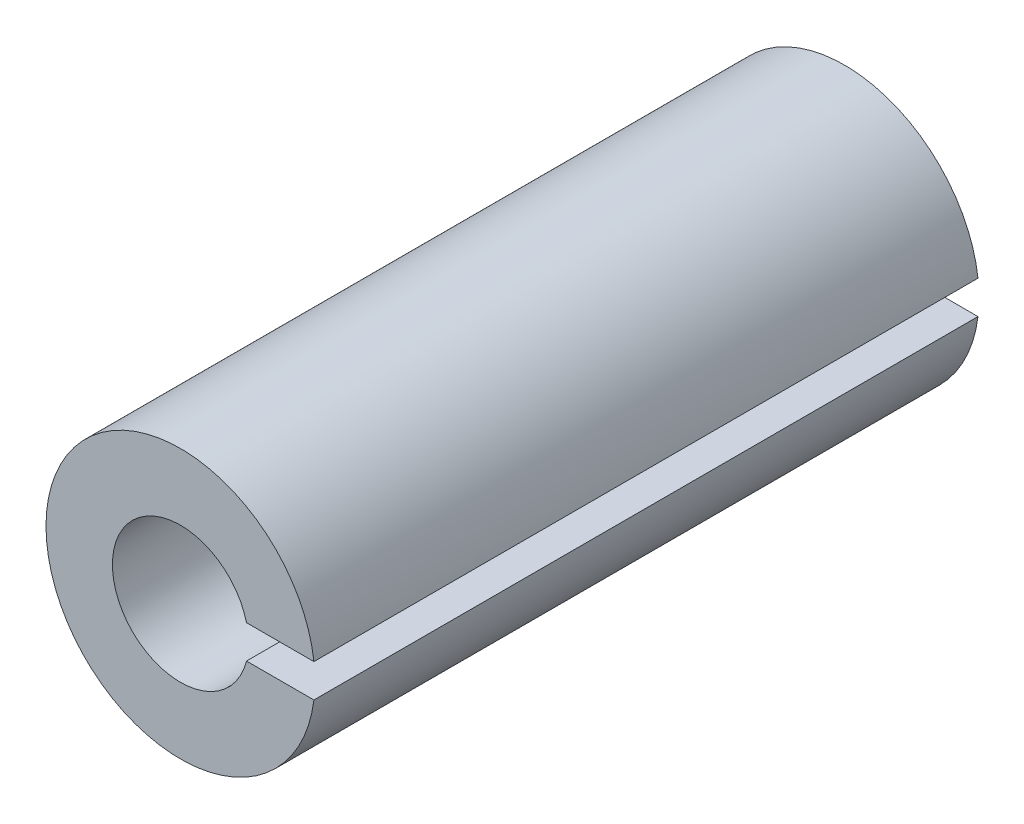
from build123d import *

# Parameters (mm, degrees)
SKETCH1_R                    = 4.05
SKETCH1_R_2                  = 2.05
BOSS_EXTRUDE1_DEPTH          = 20
CUT_EXTRUDE_THIN1_DEPTH      = 21.803965968
CUT_EXTRUDE_THIN1_DEPTH_BACK = 20
SKETCH2_W                    = 7.74426014
SKETCH2_H                    = 1


with BuildPart() as part:
    # Sketch1 → Boss-Extrude1 (new body)
    with BuildSketch(Plane.XY):
        Circle(SKETCH1_R)
        Circle(SKETCH1_R_2, mode=Mode.SUBTRACT)
    extrude(amount=BOSS_EXTRUDE1_DEPTH)

    # Sketch2 → Cut-Extrude-Thin1 (cut, two sides: drawn at the far end of the back side and taken through both)
    with BuildSketch(Plane.XY.offset(20).offset(-CUT_EXTRUDE_THIN1_DEPTH_BACK)):
        with Locations((3.87213007, 0)):
            Rectangle(SKETCH2_W, SKETCH2_H)
    extrude(amount=CUT_EXTRUDE_THIN1_DEPTH + CUT_EXTRUDE_THIN1_DEPTH_BACK, mode=Mode.SUBTRACT)


solid = part.part
